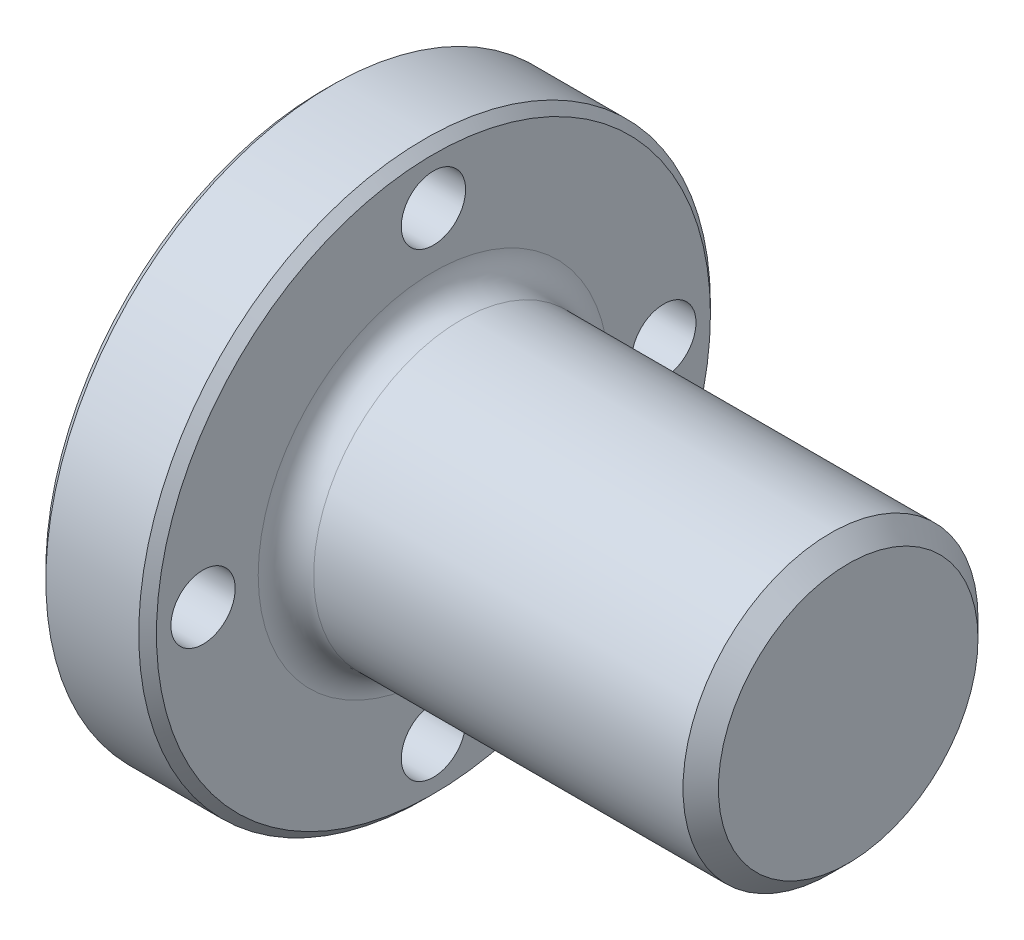
from build123d import *

# Parameters (mm, degrees)
SKETCH1_R           = 24.6126
BOSS_EXTRUDE1_DEPTH = 9.525
BOSS_EXTRUDE2_START = 9.525
SKETCH2_R           = 12.7
BOSS_EXTRUDE2_DEPTH = 35.7124
SKETCH3_R           = 8.7122
BOSS_EXTRUDE4_DEPTH = 4.826
SKETCH4_R           = 2.7686
CUT_EXTRUDE2_DEPTH  = 58.078739617
FILLET1_R           = 0.381
FILLET2_R           = 2.3876
CHAMFER1_SIZE       = 0.762
CHAMFER2_SIZE       = 1.524


with BuildPart() as part:
    # Sketch1 → Boss-Extrude1 (new body)
    with BuildSketch(Plane.YZ):
        with Locations(Location((0, 0, 0), (0, 0, 270))):
            Circle(SKETCH1_R)
    extrude(amount=BOSS_EXTRUDE1_DEPTH)

    # Sketch2 → Boss-Extrude2 (add)
    with BuildSketch(Plane.YZ.offset(BOSS_EXTRUDE2_START)):
        with Locations(Location((0, 0, 0), (0, 0, 270))):
            Circle(SKETCH2_R)
    extrude(amount=BOSS_EXTRUDE2_DEPTH)

    # Sketch3 → Boss-Extrude4 (add)
    with BuildSketch(Plane.YZ):
        with Locations(Location((0, 0, 0), (0, 0, 270))):
            Circle(SKETCH3_R)
    extrude(amount=-BOSS_EXTRUDE4_DEPTH)

    # Sketch4 → Cut-Extrude2 (cut, through all)
    with BuildSketch(Plane.YZ):
        with Locations(Location((0, 19.8374, 0), (0, 0, 270))):
            Circle(SKETCH4_R)
        with Locations(Location((19.8374, 0, 0), (0, 0, 270))):
            Circle(SKETCH4_R)
        with Locations(Location((0, -19.8374, 0), (0, 0, 270))):
            Circle(SKETCH4_R)
        with Locations(Location((-19.8374, 0, 0), (0, 0, 270))):
            Circle(SKETCH4_R)
    extrude(amount=CUT_EXTRUDE2_DEPTH, mode=Mode.SUBTRACT)

    # Fillet1
    fillet1_edges = [part.edges().sort_by_distance(p)[0] for p in [
        (0, 0, 8.7122),
    ]]
    fillet(fillet1_edges, radius=FILLET1_R)

    # Fillet2
    fillet2_edges = [part.edges().sort_by_distance(p)[0] for p in [
        (9.525, 0, 12.7),
    ]]
    fillet(fillet2_edges, radius=FILLET2_R)

    # Chamfer1
    chamfer1_edges = [part.edges().sort_by_distance(p)[0] for p in [
        (0, 0, 24.6126),
        (9.525, 0, 24.6126),
    ]]
    chamfer(chamfer1_edges, length=CHAMFER1_SIZE)

    # Chamfer2
    chamfer2_edges = [part.edges().sort_by_distance(p)[0] for p in [
        (45.2374, 0, 12.7),
    ]]
    chamfer(chamfer2_edges, length=CHAMFER2_SIZE)


solid = part.part
